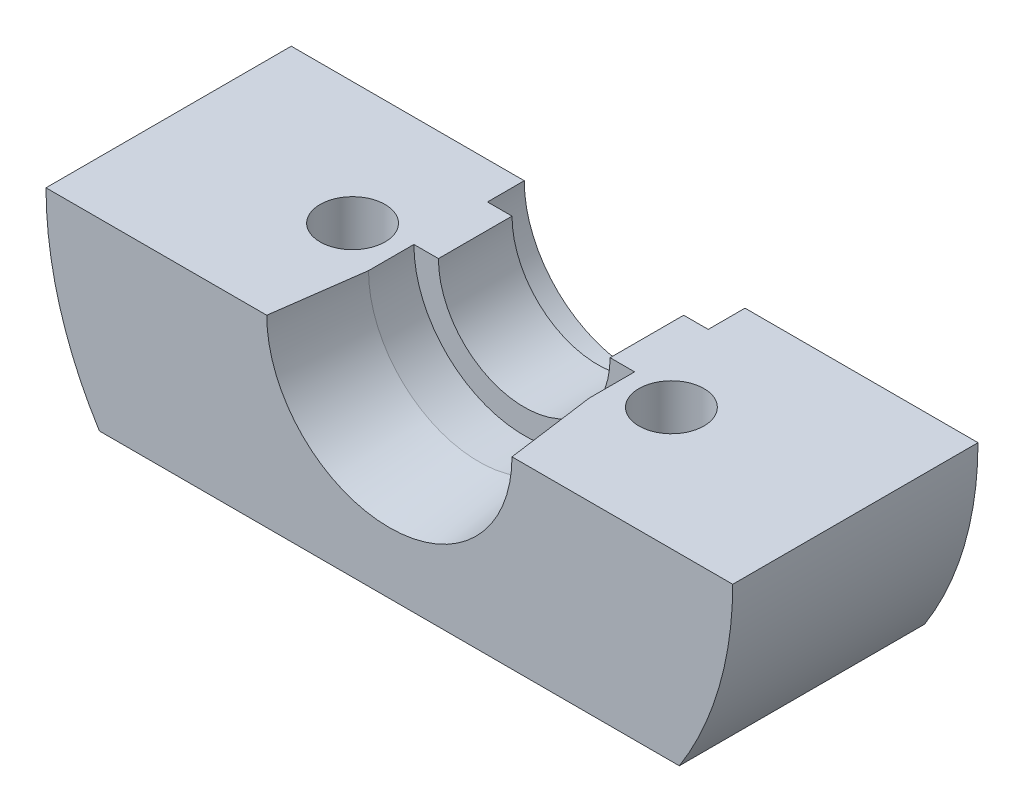
from build123d import *

# Parameters (mm, degrees)
BOSS_EXTRU_1_DEPTH      = 20
D_GAGEMENT_M51_D        = 5.3
D_GAGEMENT_M51_DEPTH    = 45
D_GAGEMENT_M51_TIP      = 1.59228064
ESQUISSE5_R             = 4.5
ENL_V_MAT_EXTRU_1_DEPTH = 20
ENL_V_MAT_EXTRU_2_DEPTH = 20


with BuildPart() as part:
    # Esquisse1 → Boss.-Extru.1 (new body)
    with BuildSketch(Plane.XY):
        with BuildLine():
            Line((-28, 0), (28, 0))
            ThreePointArc((28, 0), (0, -28), (-28, 0))
        make_face()
    extrude(amount=-BOSS_EXTRU_1_DEPTH)

    # Esquisse2 → Enlèvement de matière-Révolution1 (revolve, cut)
    with BuildSketch(Plane(origin=(0, 0, 0), x_dir=(1, 0, 0), z_dir=(0, 1, 0))):
        Polygon((12.15, 24), (12.15, 25), (0, 25), (0, 0), (10, 0), (9, 7.3), (9, 11), (7, 11), (7, 17), (9, 17), (9, 20), (7.25, 20), (7.25, 21.5), (9, 21.5), (9, 22.5), (7.25, 22.5), (7.25, 24), align=None)
    revolve(axis=Axis((0, 0, 0), (0, 0, -1)), mode=Mode.SUBTRACT)

    # Dégagement M51
    with Locations(Plane(origin=(0, 0, 0), x_dir=(1, 0, 0), z_dir=(0, 1, 0))):
        with Locations((-13, 10), (13, 10)):
            Hole(D_GAGEMENT_M51_D / 2, depth=D_GAGEMENT_M51_DEPTH)
            with Locations((0, 0, -(D_GAGEMENT_M51_DEPTH + D_GAGEMENT_M51_TIP / 2))):  # 118° drill point
                Cone(0, D_GAGEMENT_M51_D / 2, D_GAGEMENT_M51_TIP, mode=Mode.SUBTRACT)

    # Esquisse5 → Enlèv. mat.-Extru.1 (cut)
    with BuildSketch(Plane(origin=(0, -28, 0), x_dir=(0, 0, 1), z_dir=(0, -1, 0))):
        with Locations(Location((-10, 13, 0), (0, 0, 180))):
            Circle(ESQUISSE5_R)
        with Locations(Location((-10, -13, 0), (0, 0, 180))):
            Circle(ESQUISSE5_R)
    extrude(amount=-ENL_V_MAT_EXTRU_1_DEPTH, mode=Mode.SUBTRACT)

    # Esquisse6 → Enlèv. mat.-Extru.2 (cut)
    with BuildSketch(Plane.XY):
        with BuildLine():
            Line((-23.643180835, -15), (23.643180835, -15))
            ThreePointArc((23.643180835, -15), (0, -28), (-23.643180835, -15))
        make_face()
    extrude(amount=-ENL_V_MAT_EXTRU_2_DEPTH, mode=Mode.SUBTRACT)


solid = part.part
